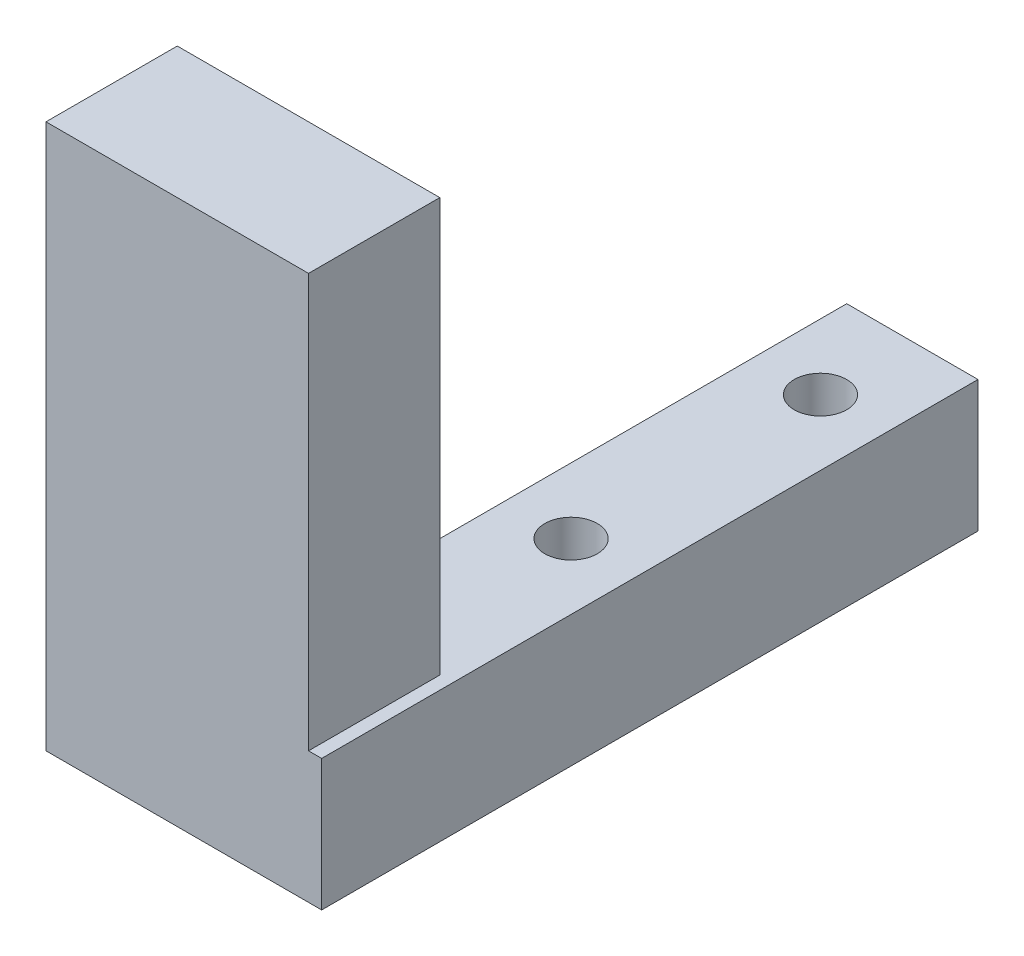
from build123d import *

# Parameters (mm, degrees)
SKETCH1_W           = 10
SKETCH1_H           = 10
BOSS_EXTRUDE1_DEPTH = 50
SKETCH3_W           = 10
SKETCH3_H           = 10
BOSS_EXTRUDE3_DEPTH = 11
SKETCH8_W           = 20
SKETCH8_H           = 10
BOSS_EXTRUDE4_DEPTH = 23
SKETCH9_R           = 2
CUT_EXTRUDE2_DEPTH  = 23
SKETCH9_4_R         = 2
CUT_EXTRUDE3_DEPTH  = 23
SKETCH8_4_W         = 20
SKETCH8_4_H         = 10
BOSS_EXTRUDE5_DEPTH = 31
SKETCH8_5_W         = 20
SKETCH8_5_H         = 10
BOSS_EXTRUDE6_DEPTH = 31.5


with BuildPart() as part:
    # Sketch1 → Boss-Extrude1 (new body)
    with BuildSketch(Plane.XY):
        with Locations((-2.851282988, -1.356707317)):
            Rectangle(SKETCH1_W, SKETCH1_H)
    extrude(amount=BOSS_EXTRUDE1_DEPTH)

    # Sketch3 → Boss-Extrude3 (add)
    with BuildSketch(Plane.ZY.offset(7.851282988)):
        with Locations((45, -1.356707317)):
            Rectangle(SKETCH3_W, SKETCH3_H)
    extrude(amount=BOSS_EXTRUDE3_DEPTH)

    # Sketch8 → Boss-Extrude4 (add)
    with BuildSketch(Plane(origin=(0, 3.643292683, 0), x_dir=(1, 0, 0), z_dir=(0, 1, 0))):
        with Locations((-8.851282988, -45)):
            Rectangle(SKETCH8_W, SKETCH8_H)
    extrude(amount=BOSS_EXTRUDE4_DEPTH)

    # Sketch9 → Cut-Extrude2 (cut)
    with BuildSketch(Plane(origin=(0, 3.643292683, 0), x_dir=(1, 0, 0), z_dir=(0, 1, 0))):
        with Locations(Location((-2.851282988, -7, 0), (0, 0, 270))):
            Circle(SKETCH9_R)
    extrude(amount=-CUT_EXTRUDE2_DEPTH, mode=Mode.SUBTRACT)

    # Sketch9<4> → Cut-Extrude3 (cut)
    with BuildSketch(Plane(origin=(0, 3.643292683, 0), x_dir=(1, 0, 0), z_dir=(0, 1, 0))):
        with Locations(Location((-2.851282988, -26, 0), (0, 0, 270))):
            Circle(SKETCH9_4_R)
    extrude(amount=-CUT_EXTRUDE3_DEPTH, mode=Mode.SUBTRACT)

    # Sketch8<4> → Boss-Extrude5 (add)
    with BuildSketch(Plane(origin=(0, 3.643292683, 0), x_dir=(1, 0, 0), z_dir=(0, 1, 0))):
        with Locations((-8.851282988, -45)):
            Rectangle(SKETCH8_4_W, SKETCH8_4_H)
    extrude(amount=BOSS_EXTRUDE5_DEPTH)

    # Sketch8<5> → Boss-Extrude6 (add)
    with BuildSketch(Plane(origin=(0, 3.643292683, 0), x_dir=(1, 0, 0), z_dir=(0, 1, 0))):
        with Locations((-8.851282988, -45)):
            Rectangle(SKETCH8_5_W, SKETCH8_5_H)
    extrude(amount=BOSS_EXTRUDE6_DEPTH)


solid = part.part
